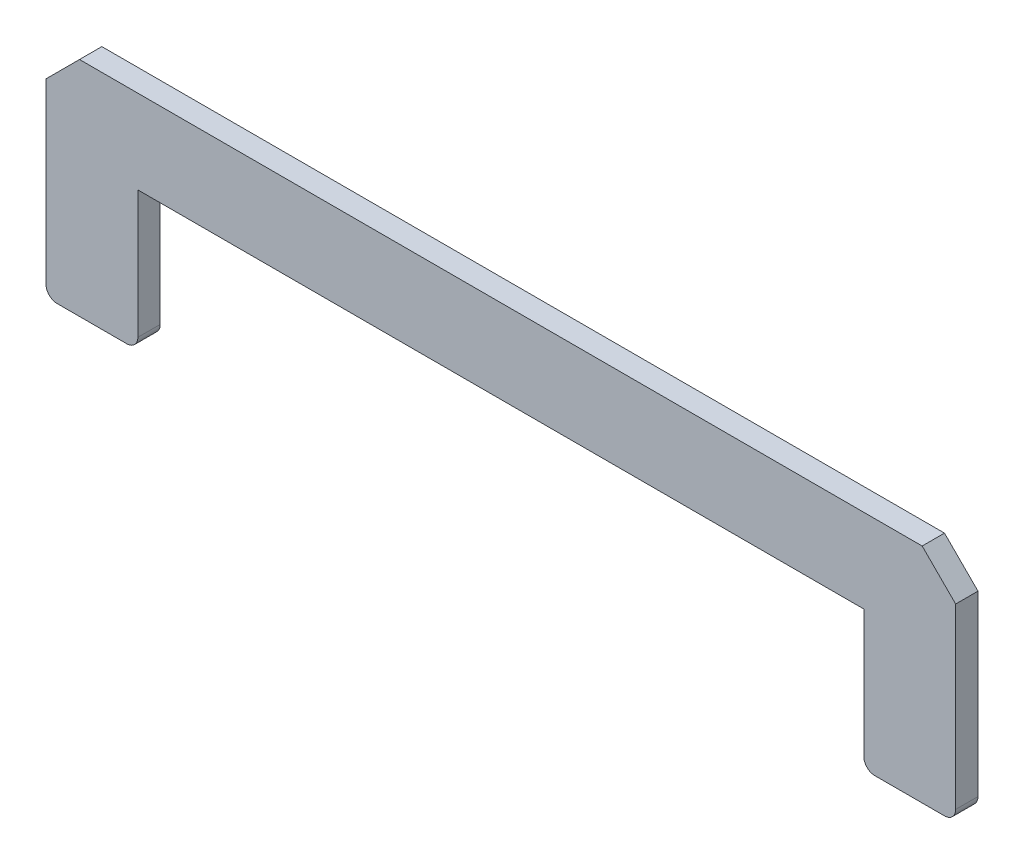
from build123d import *

# Parameters (mm, degrees)
BOSS_EXTRUDE1_DEPTH = 2.54
CHAMFER1_SIZE       = 3.81
CUT_EXTRUDE1_DEPTH  = 124.039639744
CUT_EXTRUDE2_DEPTH  = 124.039639744
FILLET1_R           = 1.27


with BuildPart() as part:
    # Sketch1 → Boss-Extrude1 (new body)
    with BuildSketch(Plane.XY):
        Polygon((5.842, 0), (16.2941, 0), (16.2941, 33.782), (98.8441, 33.782), (98.8441, 0), (109.2962, 0), (109.2962, 2.794), (115.1382, 2.794), (115.1382, 33.782), (109.2962, 33.782), (109.2962, 43.307), (5.842, 43.307), (5.842, 33.782), (0, 33.782), (0, 2.794), (5.842, 2.794), align=None)
    extrude(amount=BOSS_EXTRUDE1_DEPTH)

    # Chamfer1
    chamfer1_edges = [part.edges().sort_by_distance(p)[0] for p in [
        (5.842, 43.307, 1.27),
        (109.2962, 43.307, 1.27),
    ]]
    chamfer(chamfer1_edges, length=CHAMFER1_SIZE)

    # Sketch2 → Cut-Extrude1 (cut, through all)
    with BuildSketch(Plane.XY.offset(2.54)):
        Polygon((0, 33.782), (5.842, 33.782), (5.842, 17.995192435), (16.2941, 17.995192435), (16.2941, -3.098792672), (0, -3.098792672), align=None)
    extrude(amount=-CUT_EXTRUDE1_DEPTH, mode=Mode.SUBTRACT)

    # Sketch3 → Cut-Extrude2 (cut, through all)
    with BuildSketch(Plane.XY.offset(2.54)):
        Polygon((109.2962, 33.782), (115.1382, 33.782), (115.1382, -2.224430595), (98.8441, 0), (42.867468811, 17.995192435), (109.2962, 17.995192435), align=None)
    extrude(amount=-CUT_EXTRUDE2_DEPTH, mode=Mode.SUBTRACT)

    # Fillet1
    fillet1_edges = [part.edges().sort_by_distance(p)[0] for p in [
        (16.2941, 17.995192435, 1.27),
        (5.842, 17.995192435, 1.27),
        (98.8441, 17.995192435, 1.27),
        (109.2962, 17.995192435, 1.27),
    ]]
    fillet(fillet1_edges, radius=FILLET1_R)


solid = part.part
